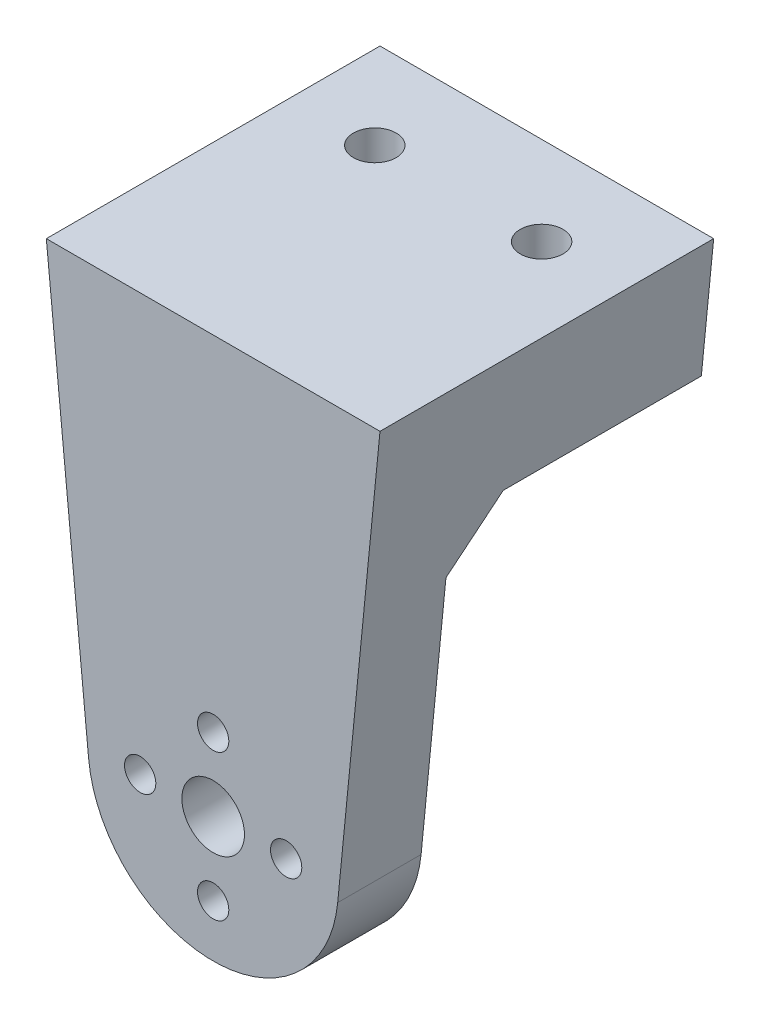
from build123d import *

# Parameters (mm, degrees)
SKETCH1_R           = 1.5
BOSS_EXTRUDE1_DEPTH = 8
BOSS_EXTRUDE2_DEPTH = 24
CHAMFER1_SIZE       = 5
CUT_EXTRUDE2_REACH  = 51.315
SKETCH5_R           = 3
SKETCH6_R           = 2.05
CUT_EXTRUDE6_DEPTH  = 5


with BuildPart() as part:
    # Sketch1 → Boss-Extrude1 (new body)
    with BuildSketch(Plane.XY):
        with BuildLine():
            ThreePointArc((-11.942152172, -1.176860869), (0, -12), (11.942152172, -1.176860869))
            Line((11.942152172, -1.176860869), (16, 40))
            Line((16, 40), (-16, 40))
            Line((-16, 40), (-11.942152172, -1.176860869))
        make_face()
        with Locations((0, -7)):
            Circle(SKETCH1_R, mode=Mode.SUBTRACT)
        with Locations((7, 0)):
            Circle(SKETCH1_R, mode=Mode.SUBTRACT)
        with Locations((-7, 0)):
            Circle(SKETCH1_R, mode=Mode.SUBTRACT)
        with BuildLine():
            ThreePointArc((0, 5.5), (-1.5, 7), (0, 8.5))
            ThreePointArc((0, 8.5), (1.5, 7), (0, 5.5))
        make_face(mode=Mode.SUBTRACT)
    extrude(amount=BOSS_EXTRUDE1_DEPTH)

    # Sketch3 → Boss-Extrude2 (add)
    with BuildSketch(Plane(origin=(0, 0, 0), x_dir=(-1, 0, 0), z_dir=(0, 0, -1))):
        Polygon((14.817438413, 28), (-14.817438413, 28), (-16, 40), (16, 40), align=None)
    extrude(amount=BOSS_EXTRUDE2_DEPTH)

    # Chamfer1
    chamfer1_edges = [part.edges().sort_by_distance(p)[0] for p in [
        (0, 28, 0),
    ]]
    chamfer(chamfer1_edges, length=CHAMFER1_SIZE)

    # Sketch5 → Cut-Extrude2 (cut, up to next)
    with BuildSketch(Plane(origin=(0, 0, 0), x_dir=(-1, 0, 0), z_dir=(0, 0, -1)), mode=Mode.PRIVATE) as cut_extrude2_sk1:
        Circle(SKETCH5_R)
    cut_extrude2_tool1 = extrude(cut_extrude2_sk1.sketch, amount=-CUT_EXTRUDE2_REACH, mode=Mode.PRIVATE) & part.part
    add(cut_extrude2_tool1.solids().sort_by_distance((0, 0, 0))[0], mode=Mode.SUBTRACT)

    # Sketch6 → Cut-Extrude6 (cut)
    with BuildSketch(Plane.XZ.offset(-40)):
        with Locations(Location((-8, -15.5, 0), (0, 0, 180))):
            Circle(SKETCH6_R)
        with Locations((8, -15.5)):
            Circle(SKETCH6_R)
    extrude(amount=CUT_EXTRUDE6_DEPTH, mode=Mode.SUBTRACT)


solid = part.part
